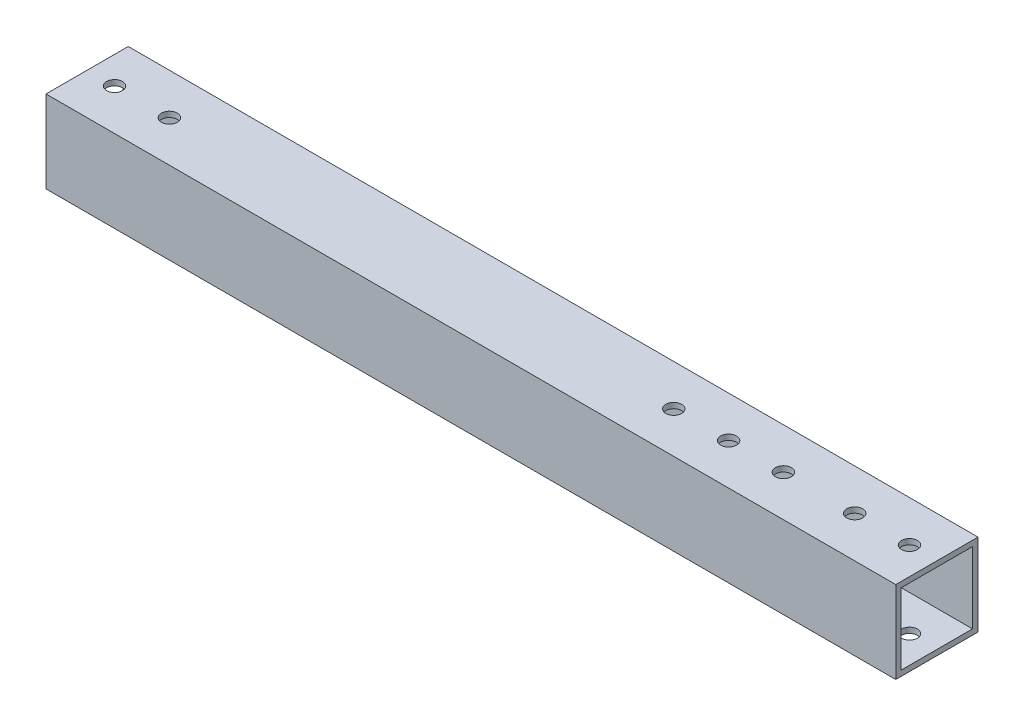
from build123d import *

# Parameters (mm, degrees)
SKETCH_1_W          = 15
SKETCH_1_H          = 15
SKETCH_1_W_2        = 13
SKETCH_1_H_2        = 13
EXTRUDE_1_DEPTH     = 155
SKETCH_2_R          = 1.45
CUT_EXTRUDE_1_DEPTH = 156.904618277


with BuildPart() as part:
    # 草图1 → 凸台-拉伸1 (new body)
    with BuildSketch(Plane(origin=(0, 0, 0), x_dir=(0, 0, -1), z_dir=(1, 0, 0))):
        Rectangle(SKETCH_1_W, SKETCH_1_H)
        Rectangle(SKETCH_1_W_2, SKETCH_1_H_2, mode=Mode.SUBTRACT)
    extrude(amount=EXTRUDE_1_DEPTH)

    # 草图2 → 切除-拉伸1 (cut, through all)
    with BuildSketch(Plane(origin=(0, 7.5, 0), x_dir=(1, 0, 0), z_dir=(0, 1, 0))):
        with Locations(Location((5, 0, 0), (0, 0, 270))):
            Circle(SKETCH_2_R)
        with Locations(Location((15, 0, 0), (0, 0, 270))):
            Circle(SKETCH_2_R)
        with Locations(Location((140, 0, 0), (0, 0, 270))):
            Circle(SKETCH_2_R)
        with Locations(Location((150, 0, 0), (0, 0, 270))):
            Circle(SKETCH_2_R)
        with Locations(Location((127, 0, 0), (0, 0, 270))):
            Circle(SKETCH_2_R)
        with Locations(Location((117, 0, 0), (0, 0, 270))):
            Circle(SKETCH_2_R)
        with Locations(Location((107, 0, 0), (0, 0, 270))):
            Circle(SKETCH_2_R)
    extrude(amount=-CUT_EXTRUDE_1_DEPTH, mode=Mode.SUBTRACT)


solid = part.part
